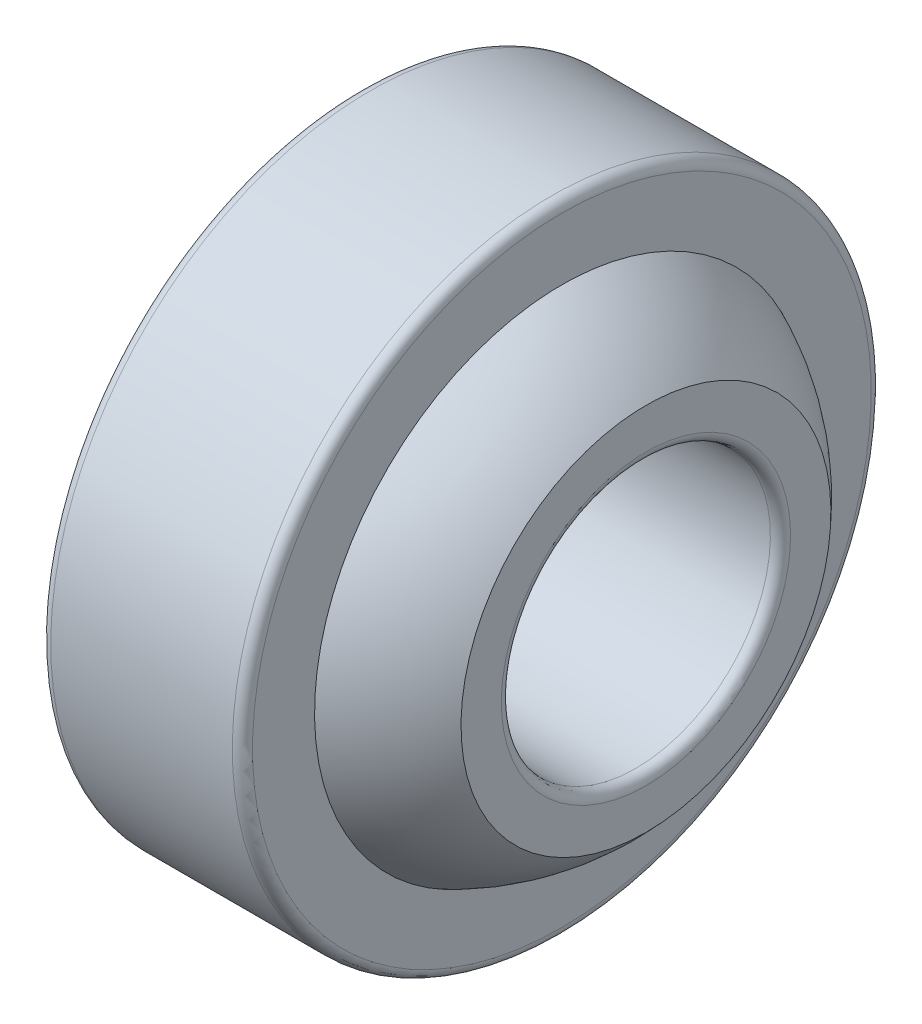
from build123d import *


with BuildPart() as part:
    # 草图2 → 旋转1 (revolve)
    with BuildSketch(Plane.XY, mode=Mode.PRIVATE) as revolve_1_sk:
        with BuildLine():
            Line((-3, 7.355073253), (-3, 9.2))
            ThreePointArc((-3, 9.2), (-2.912132034, 9.412132034), (-2.7, 9.5))
            Line((-2.7, 9.5), (2.7, 9.5))
            ThreePointArc((2.7, 9.5), (2.912132034, 9.412132034), (3, 9.2))
            Line((3, 9.2), (3, 7.355073253))
            ThreePointArc((3, 7.355073253), (0, 8), (-3, 7.355073253))
        make_face()
    revolve(revolve_1_sk.sketch.rotate(Axis((-7, 0, 0), (1, 0, 0)), 180), axis=Axis((-7, 0, 0), (1, 0, 0)))


with BuildPart() as body_2:
    # 草图3 → 旋转2 (revolve)
    with BuildSketch(Plane.XY, mode=Mode.PRIVATE) as revolve_2_sk:
        with BuildLine():
            Line((-5.5, 5.5), (-5.5, 4.3))
            ThreePointArc((-5.5, 4.3), (-5.412132034, 4.087867966), (-5.2, 4))
            Line((-5.2, 4), (5.2, 4))
            ThreePointArc((5.2, 4), (5.412132034, 4.087867966), (5.5, 4.3))
            Line((5.5, 4.3), (5.5, 5.5))
            ThreePointArc((5.5, 5.5), (0, 8), (-5.5, 5.5))
        make_face()
    revolve(revolve_2_sk.sketch.rotate(Axis((-7, 0, 0), (1, 0, 0)), 180), axis=Axis((-7, 0, 0), (1, 0, 0)))


solid = Compound([part.part, body_2.part])
